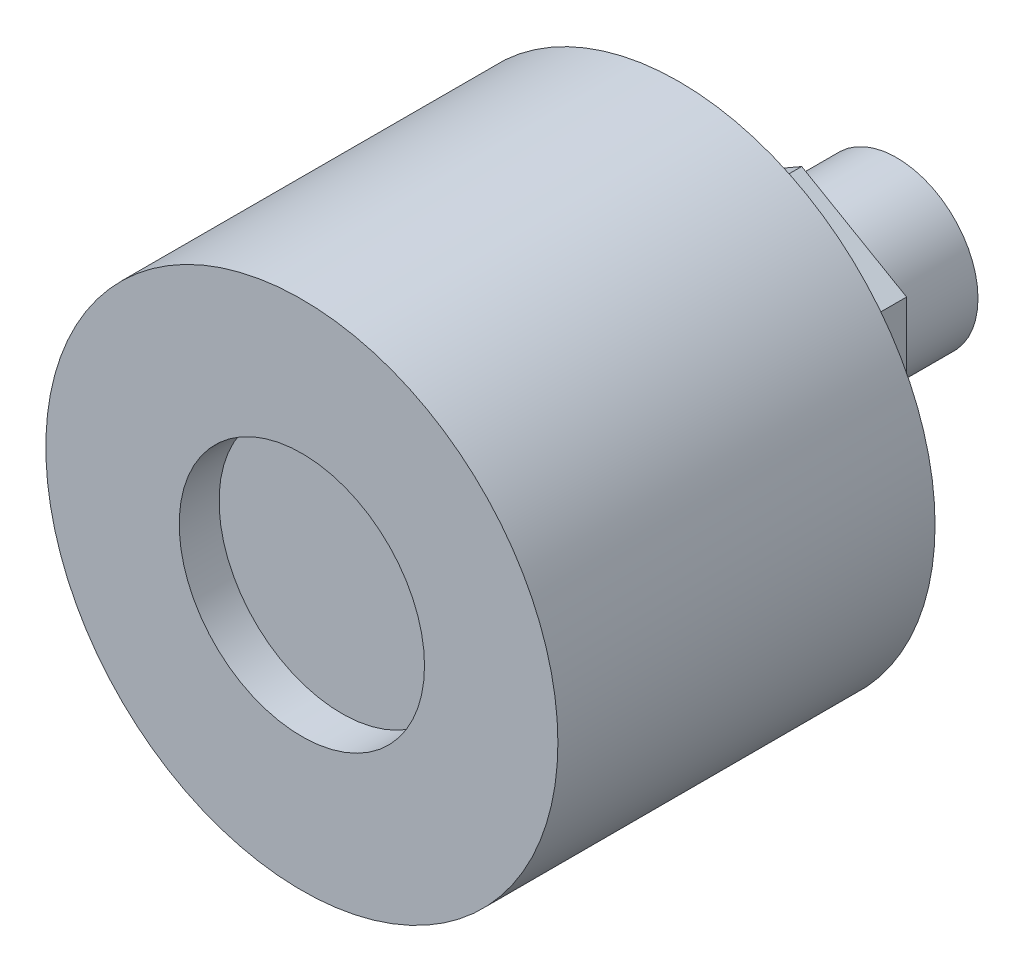
from build123d import *

# Parameters (mm, degrees)
BOSS_EXTRUDE1_DEPTH      = 1
BOSS_EXTRUDE1_DEPTH_BACK = 0.3
SKETCH3_R                = 8.35
SKETCH3_R_2              = 4
SKETCH4_R                = 8.35
BOSS_EXTRUDE2_DEPTH      = 11
BOSS_EXTRUDE4_DEPTH      = 4
SKETCH6_R                = 2.65
BOSS_EXTRUDE5_DEPTH      = 3.1
SKETCH7_R                = 0.244312337
CUT_EXTRUDE1_DEPTH       = 2


with BuildPart() as part:
    # Sketch3 → Boss-Extrude1 (new, two sides: drawn at the far end of the back side and taken through both)
    with BuildSketch(Plane.XY.offset(-BOSS_EXTRUDE1_DEPTH_BACK)):
        Circle(SKETCH3_R)
        Circle(SKETCH3_R_2, mode=Mode.SUBTRACT)
    extrude(amount=BOSS_EXTRUDE1_DEPTH + BOSS_EXTRUDE1_DEPTH_BACK)

    # Sketch4 → Boss-Extrude2 (add)
    with BuildSketch(Plane(origin=(0, 0, -0.3), x_dir=(-1, 0, 0), z_dir=(0, 0, -1))):
        with Locations(Location((0, 0, 0), (0, 0, 180))):
            Circle(SKETCH4_R)
    extrude(amount=BOSS_EXTRUDE2_DEPTH)

    # Sketch5 → Boss-Extrude4 (add)
    with BuildSketch(Plane(origin=(0, 0, -11.3), x_dir=(-1, 0, 0), z_dir=(0, 0, -1))):
        Polygon((0, 3.95), (-3.420800345, 1.975), (-3.420800345, -1.975), (0, -3.95), (3.420800345, -1.975), (3.420800345, 1.975), align=None)
    extrude(amount=BOSS_EXTRUDE4_DEPTH)

    # Sketch6 → Boss-Extrude5 (add)
    with BuildSketch(Plane(origin=(0, 0, -15.3), x_dir=(-1, 0, 0), z_dir=(0, 0, -1))):
        with Locations(Location((0, 0, 0), (0, 0, 180))):
            Circle(SKETCH6_R)
    extrude(amount=BOSS_EXTRUDE5_DEPTH)

    # Sketch7 → Cut-Extrude1 (cut)
    with BuildSketch(Plane(origin=(0, 0, -18.4), x_dir=(-1, 0, 0), z_dir=(0, 0, -1))):
        Circle(SKETCH7_R)
    extrude(amount=-CUT_EXTRUDE1_DEPTH, mode=Mode.SUBTRACT)


solid = part.part
